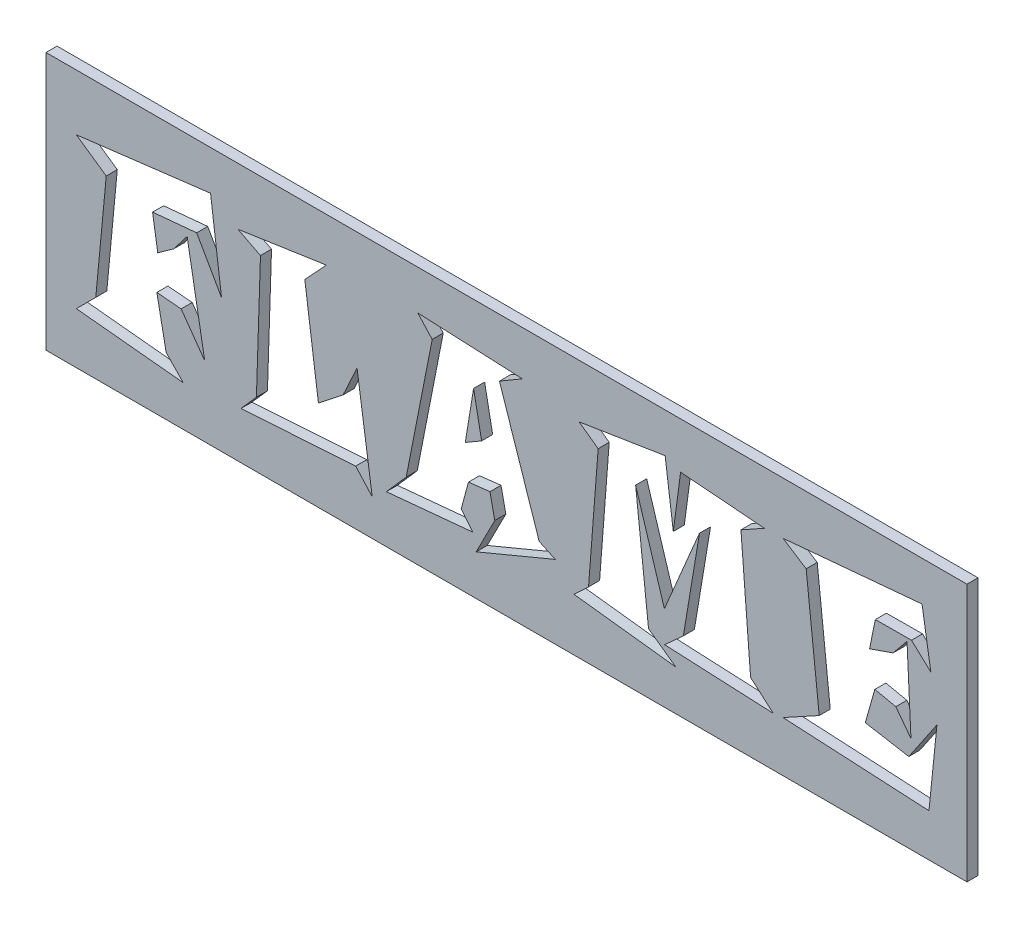
from build123d import *

# Parameters (mm, degrees)
SKETCH2_W           = 250
SKETCH2_H           = 70
BOSS_EXTRUDE2_DEPTH = 3
CUT_EXTRUDE1_DEPTH  = 25


with BuildPart() as part:
    # Sketch2 → Boss-Extrude2 (new body)
    with BuildSketch(Plane.XY):
        with Locations((125, 35)):
            Rectangle(SKETCH2_W, SKETCH2_H)
    extrude(amount=BOSS_EXTRUDE2_DEPTH)

    # Sketch1 → Cut-Extrude1 (cut)
    # profile 1 of 5: a face of its own
    with BuildSketch(Plane.XY):
        Polygon((47.65472561, 36.187258524), (40.89783515, 48.055483808), (28.928486336, 46.924738874), (30.335022717, 38.053447318), (34.692527585, 41.188276769), (38.314588593, 45.904310519), (43.076587584, 19.088188789), (36.687419054, 28.060603876), (30.086810414, 28.639765915), (32.62409173, 15.769498373), (37.257388045, 10.989113286), (8.234934737, 13.894116531), (13.511744429, 19.170926223), (16.352396337, 49.131070452), (8.234934737, 54.766409026), (44.66698493, 59.234230473), align=None)
    # profile 2 of 5: a face of its own
    with BuildSketch(Plane.XY):
        Polygon((88.557171303, 9.81240311), (84.07096376, 14.795035259), (52.915723259, 12.754178549), (57.116946307, 17.506984491), (58.220112096, 51.374174224), (52.079155869, 54.490617579), (76.10978398, 58.057520298), (70.253812248, 51.76028225), (73.949417643, 24.521280302), (80.660342861, 29.825669139), (84.43868569, 38.04425427), align=None)
    # profile 3 of 5: a face of its own
    with BuildSketch(Plane.XY):
        Polygon((138.284943312, 19.961528372), (116.773210419, 10.989113286), (121.829386954, 20.880833197), (120.514781055, 27.003403328), (114.67719542, 26.332310806), (112.700690047, 19.014644403), (115.890677788, 15.162757189), (92.393246475, 12.938039514), (97.780372746, 19.060609645), (104.840633798, 54.968656088), (100.906009149, 59.234230473), (129.294142129, 57.928817623), (123.088834563, 54.279177469), (133.872280154, 21.983998986), align=None)
        Polygon((118.244098139, 37.805235015), (116.074538753, 49.057526067), (113.813048885, 35.221988458), align=None, mode=Mode.SUBTRACT)
    # profile 4 of 5: a face of its own
    with BuildSketch(Plane.XY):
        Polygon((197.426396723, 13.342533636), (167.925904906, 14.73987697), (173.009660585, 19.336401092), (177.394744598, 45.683677361), (167.861553568, 23.151516113), (160.056655608, 48.322082207), (163.55920699, 16.321081268), (171.005576068, 10.989113286), (143.297728659, 14.280224557), (147.278318548, 18.003409096), (149.88914425, 51.797054443), (144.70426504, 55.520238982), (168.072993678, 59.234230473), (170.279325256, 42.539654861), (172.274216725, 57.46916521), (195.008625034, 55.648941658), (188.647035649, 52.091231987), (191.267054399, 18.711273811), align=None)
    # profile 5 of 5: a face of its own
    with BuildSketch(Plane.XY):
        Polygon((241.858972942, 32.850182011), (239.689413556, 11.577468373), (200.085761719, 13.682676421), (209.894744196, 19.060609645), (206.355420622, 51.797054443), (200.085761719, 55.823609575), (237.804838666, 59.234230473), (240.19503121, 44.4334228), (234.945800662, 49.296545321), (225.127625137, 49.241387031), (223.564806935, 41.583577844), (229.944782417, 43.808295519), (233.732318294, 48.441591834), (234.79871189, 26.130063745), (230.689419325, 31.544769161), (224.989729413, 32.758251529), (222.406482857, 23.629554622), (234.210356803, 21.579504864), align=None)
    extrude(amount=CUT_EXTRUDE1_DEPTH, mode=Mode.SUBTRACT)


with BuildPart() as cut_extrude1_piece_1:
    # of the separate pieces the step leaves, piece 1, a body of its own (cut_extrude1_pieces)
    add(part.part.solids().sort_by_distance((0, 0, 0))[0])


with BuildPart() as cut_extrude1_piece_2:
    # of the separate pieces the step leaves, piece 2, a body of its own (cut_extrude1_pieces)
    add(part.part.solids().sort_by_distance((113.813048885, 35.221988458, 0))[0])


solid = Compound([cut_extrude1_piece_1.part, cut_extrude1_piece_2.part])
